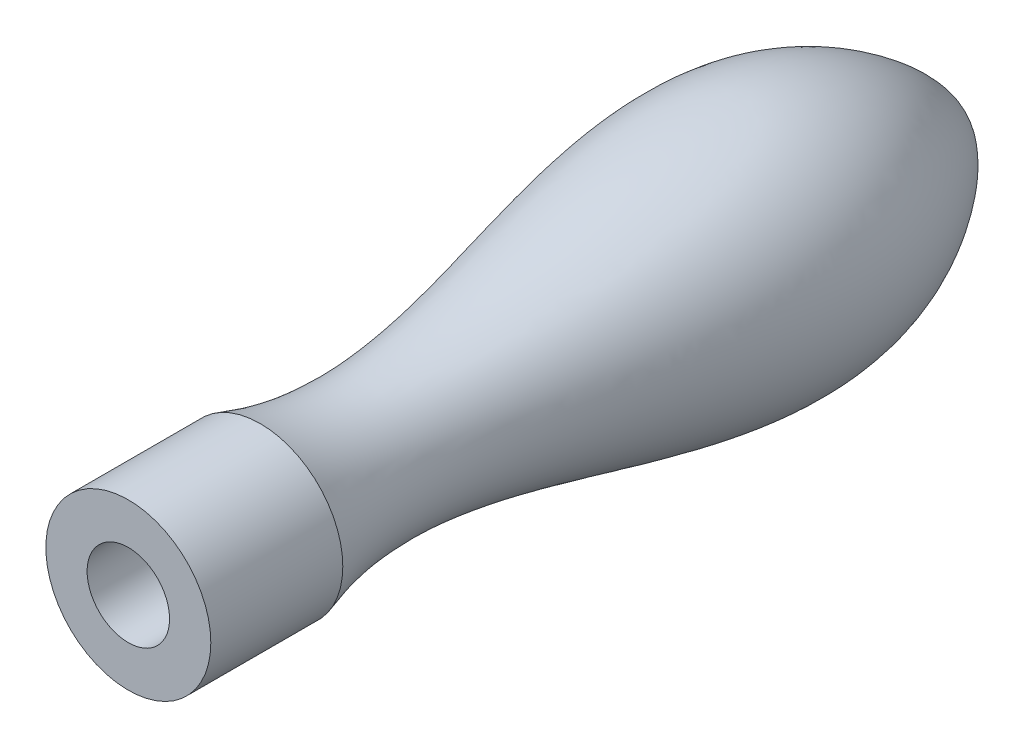
from build123d import *

# Parameters (mm, degrees)
SKETCH_5_R          = 1.2
CUT_EXTRUDE_1_DEPTH = 1.2


with BuildPart() as part:
    # Эскиз1 → Повернуть1 (revolve)
    with BuildSketch(Plane(origin=(0, 0, 0), x_dir=(0, 0, -1), z_dir=(1, 0, 0)), mode=Mode.PRIVATE) as revolve_1_sk:
        with BuildLine():
            Line((0, 0), (0, 10))
            Line((0, 10), (6, 10))
            Line((6, 10), (16, 10))
            add(Edge.make_bspline(
                [(16, 10), (34.123888975, 3.793352477), (59.354704709, 17.880741336), (89.090921455, 13.973548109), (100.000000001, 3.714669584), (100, 0)],
                knots=[0, 0, 0, 0, 0.303770866, 0.428946776, 0.5, 0.5, 0.5, 0.5], degree=3))
            Line((100, 0), (0, 0))
        make_face()
    revolve(revolve_1_sk.sketch.rotate(Axis((0, 0, 0), (0, 0, -1)), 90), axis=Axis((0, 0, 0), (0, 0, -1)))

    # Эскиз2 → Вырез-Повернуть1 (revolve, cut)
    with BuildSketch(Plane(origin=(0, 0, 0), x_dir=(0, 0, -1), z_dir=(1, 0, 0)), mode=Mode.PRIVATE) as cut_revolve_1_sk:
        Polygon((0, 0), (0, 5), (80, 5), (82.886751346, 0), align=None)
    revolve(cut_revolve_1_sk.sketch.rotate(Axis((0, 0, 0), (0, 0, -1)), 180), axis=Axis((0, 0, 0), (0, 0, -1)), mode=Mode.SUBTRACT)

    # Эскиз3 → Вырез-Повернуть2 (revolve, cut)
    with BuildSketch(Plane(origin=(0, 0, 0), x_dir=(0, 0, -1), z_dir=(1, 0, 0)), mode=Mode.PRIVATE) as cut_revolve_2_sk:
        with BuildLine():
            Line((14.8, 0), (17.2, 0))
            Line((17.2, 0), (17.2, 6))
            ThreePointArc((17.2, 6), (16, 7.2), (14.8, 6))
            Line((14.8, 6), (14.8, 0))
        make_face()
    revolve(cut_revolve_2_sk.sketch.rotate(Axis((0, 0, 0), (0, 0, -1)), 180), axis=Axis((0, 0, 0), (0, 0, -1)), mode=Mode.SUBTRACT)


with BuildPart() as body_2:
    # Эскиз5 → Повернуть2 (revolve)
    with BuildSketch(Plane(origin=(0, 0, 0), x_dir=(0, 0, -1), z_dir=(1, 0, 0)), mode=Mode.PRIVATE) as revolve_2_sk:
        with Locations((16, 5.5)):
            Circle(SKETCH_5_R)
    revolve(revolve_2_sk.sketch.rotate(Axis((0, 0, -17.2), (0, 0, 1)), 270), axis=Axis((0, 0, -17.2), (0, 0, 1)))

    # Эскиз6 → Вырез-Вытянуть1 (cut, symmetric)
    with BuildSketch(Plane.XY.offset(-16)):
        with BuildLine():
            Line((-2.089403248, 3.618952583), (-3.439432084, 5.957271118))
            ThreePointArc((-3.439432084, 5.957271118), (-5.457369865, 4.18758718), (-6.644472555, 1.780381055))
            Line((-6.644472555, 1.780381055), (-4.036417117, 1.081554707))
            ThreePointArc((-4.036417117, 1.081554707), (-3.315270092, 2.543896214), (-2.089403248, 3.618952583))
        make_face()
    extrude(amount=CUT_EXTRUDE_1_DEPTH, both=True, mode=Mode.SUBTRACT)


solid = Compound([part.part, body_2.part])
